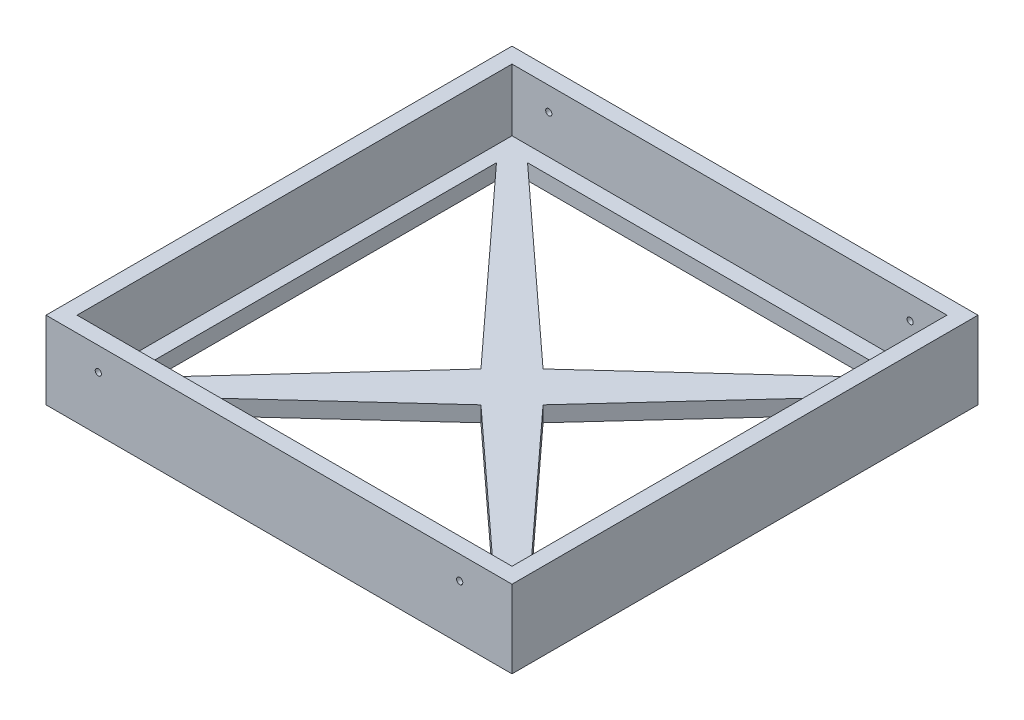
from build123d import *

# Parameters (mm, degrees)
SKETCH1_W                                  = 381
SKETCH1_H                                  = 381
SKETCH1_W_2                                = 355.6
SKETCH1_H_2                                = 355.6
BOSS_EXTRUDE2_DEPTH                        = 50.8
SKETCH2_R                                  = 2.54
CUT_EXTRUDE3_DEPTH                         = 418.750858766
MIRROR1_AT_THE_SECOND_PLANE_COPY_1_SKETC_R = 2.54
MIRROR1_AT_THE_SECOND_PLANE_COPY_1_DEPTH   = 418.750858766
SKETCH3_W                                  = 381
SKETCH3_H                                  = 381
BOSS_EXTRUDE3_DEPTH                        = 12.7
CUT_EXTRUDE4_DEPTH                         = 275.155320941


with BuildPart() as part:
    # Sketch1 → Boss-Extrude2 (new body)
    with BuildSketch(Plane(origin=(0, 0, 0), x_dir=(1, 0, 0), z_dir=(0, 1, 0))):
        Rectangle(SKETCH1_W, SKETCH1_H)
        Rectangle(SKETCH1_W_2, SKETCH1_H_2, mode=Mode.SUBTRACT)
    extrude(amount=BOSS_EXTRUDE2_DEPTH)

    # Sketch2 → Cut-Extrude3 (cut, through all)
    with BuildSketch(Plane.XY.offset(-177.8)):
        with Locations((-147.717881469, 31.75)):
            Circle(SKETCH2_R)
    cut_extrude3 = extrude(amount=-CUT_EXTRUDE3_DEPTH, mode=Mode.SUBTRACT)

    # Mirror1: Cut-Extrude3 across plane
    add(cut_extrude3.mirror(Plane.XY), mode=Mode.SUBTRACT)

    # Mirror1 at the second plane: Cut-Extrude3 across plane
    add(cut_extrude3.mirror(Plane(origin=(0, 0, 0), x_dir=(0, 0, 1), z_dir=(1, 0, 0))), mode=Mode.SUBTRACT)

    # Mirror1 at the second plane copy 1 sketc → Mirror1 at the second plane copy 1 (cut, through all)
    with BuildSketch(Plane(origin=(0, 0, 177.8), x_dir=(-1, 0, 0), z_dir=(0, 0, -1))):
        with Locations((-147.717881469, 31.75)):
            Circle(MIRROR1_AT_THE_SECOND_PLANE_COPY_1_SKETC_R)
    extrude(amount=-MIRROR1_AT_THE_SECOND_PLANE_COPY_1_DEPTH, mode=Mode.SUBTRACT)

    # Sketch3 → Boss-Extrude3 (add)
    with BuildSketch(Plane.XZ):
        Rectangle(SKETCH3_W, SKETCH3_H)
    extrude(amount=BOSS_EXTRUDE3_DEPTH)

    # Sketch4 → Cut-Extrude4 (cut, through all)
    with BuildSketch(Plane(origin=(0, 0, 0), x_dir=(1, 0, 0), z_dir=(0, 1, 0))):
        Polygon((-152.4, 165.1), (0, 25.4), (152.4, 165.1), align=None)
        Polygon((165.1, 152.4), (165.1, -152.4), (25.4, 0), align=None)
        Polygon((152.4, -165.1), (-152.4, -165.1), (0, -25.4), align=None)
        Polygon((-165.1, -152.4), (-165.1, 152.4), (-25.4, 0), align=None)
    extrude(amount=-CUT_EXTRUDE4_DEPTH, mode=Mode.SUBTRACT)


solid = part.part
